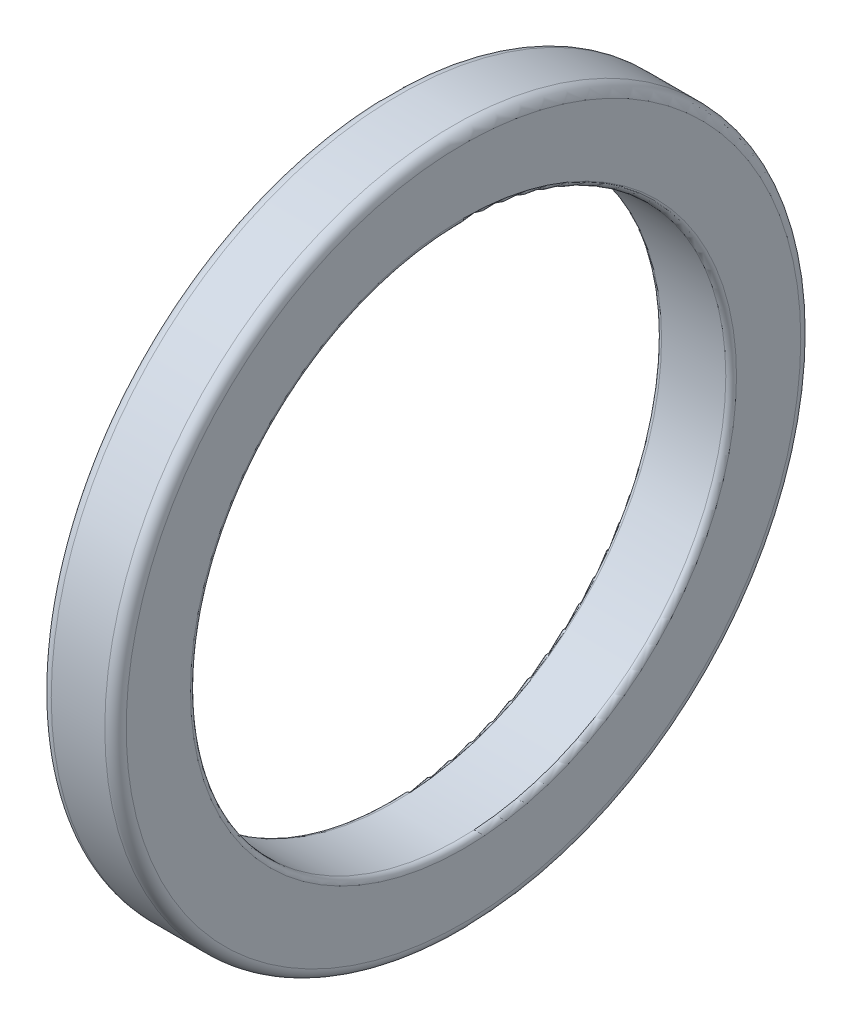
from build123d import *

# Parameters (mm, degrees)
SKETCH1_R           = 32.5
SKETCH1_R_2         = 25
BOSS_EXTRUDE1_DEPTH = 7
FILLET1_R           = 1
FILLET2_R           = 0.5


with BuildPart() as part:
    # Sketch1 → Boss-Extrude1 (new body)
    with BuildSketch(Plane(origin=(0, 0, 0), x_dir=(0, 0, -1), z_dir=(1, 0, 0))):
        Circle(SKETCH1_R)
        Circle(SKETCH1_R_2, mode=Mode.SUBTRACT)
    extrude(amount=BOSS_EXTRUDE1_DEPTH)

    # Fillet1
    fillet1_edges = [part.edges().sort_by_distance(p)[0] for p in [
        (0, 0, 32.5),
        (7, 0, 32.5),
    ]]
    fillet(fillet1_edges, radius=FILLET1_R)

    # Fillet2
    fillet2_edges = [part.edges().sort_by_distance(p)[0] for p in [
        (0, 0, 25),
        (7, 0, 25),
    ]]
    fillet(fillet2_edges, radius=FILLET2_R)


solid = part.part
